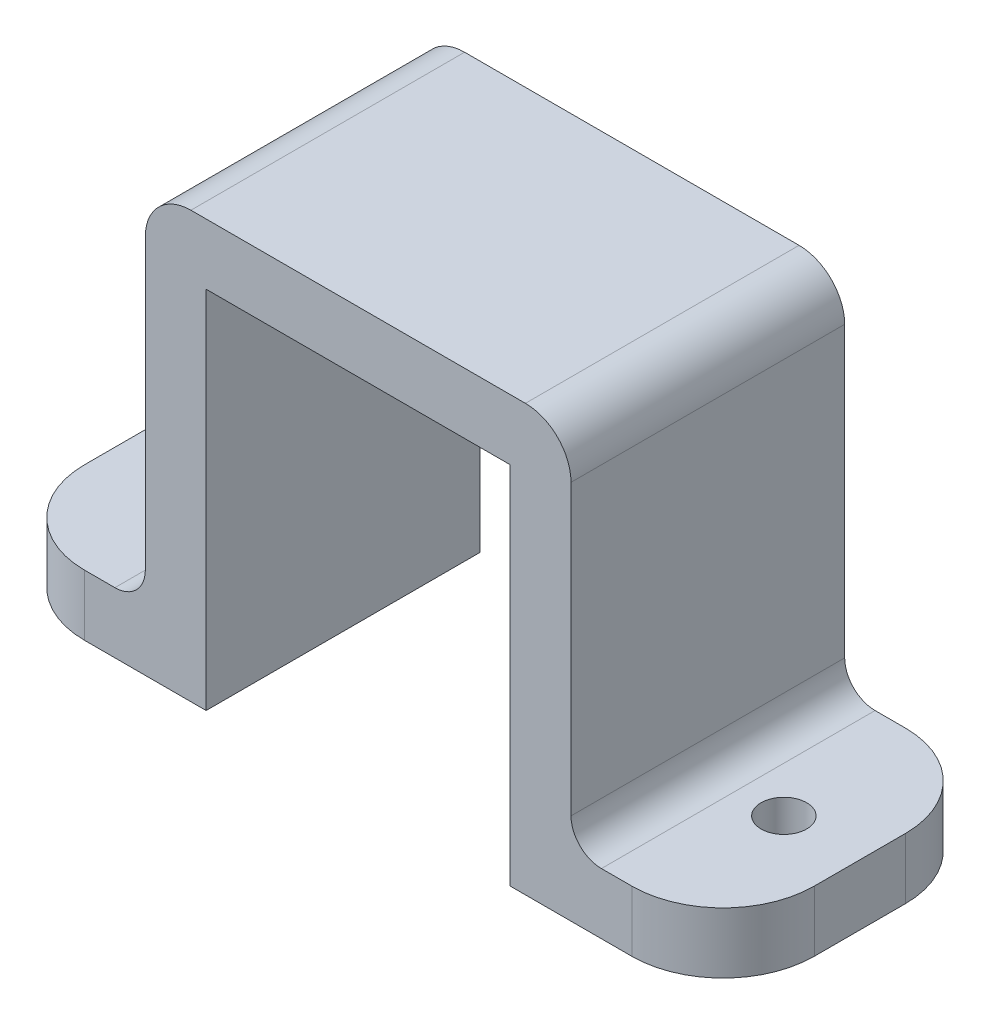
from build123d import *

# Parameters (mm, degrees)
SALIENTE_EXTRUIR1_DEPTH = 9
REDONDEO1_R             = 3
REDONDEO2_R             = 1.5
CROQUIS3_R              = 0.75
CORTAR_EXTRUIR1_DEPTH   = 9
REDONDEO3_R             = 1


with BuildPart() as part:
    # Croquis2 → Saliente-Extruir1 (new body)
    with BuildSketch(Plane.XY):
        Polygon((10, 0), (17, 0), (17, 2), (12, 2), (12, 14), (-2, 14), (-2, 2), (-7, 2), (-7, 0), (0, 0), (0, 12), (10, 12), align=None)
    extrude(amount=SALIENTE_EXTRUIR1_DEPTH)

    # Redondeo1
    redondeo1_edges = [part.edges().sort_by_distance(p)[0] for p in [
        (-7, 1, 0),
        (17, 1, 0),
        (17, 1, 9),
        (-7, 1, 9),
    ]]
    fillet(redondeo1_edges, radius=REDONDEO1_R)

    # Redondeo2
    redondeo2_edges = [part.edges().sort_by_distance(p)[0] for p in [
        (-2, 14, 4.5),
        (12, 14, 4.5),
    ]]
    fillet(redondeo2_edges, radius=REDONDEO2_R)

    # Croquis3 → Cortar-Extruir1 (cut)
    with BuildSketch(Plane(origin=(0, 2, 0), x_dir=(1, 0, 0), z_dir=(0, 1, 0))):
        with Locations(Location((-4.5, -4.5, 0), (0, 0, 270))):
            Circle(CROQUIS3_R)
        with Locations(Location((14.5, -4.5, 0), (0, 0, 270))):
            Circle(CROQUIS3_R)
    extrude(amount=-CORTAR_EXTRUIR1_DEPTH, mode=Mode.SUBTRACT)

    # Redondeo3
    redondeo3_edges = [part.edges().sort_by_distance(p)[0] for p in [
        (-2, 2, 4.5),
        (12, 2, 4.5),
    ]]
    fillet(redondeo3_edges, radius=REDONDEO3_R)


solid = part.part
